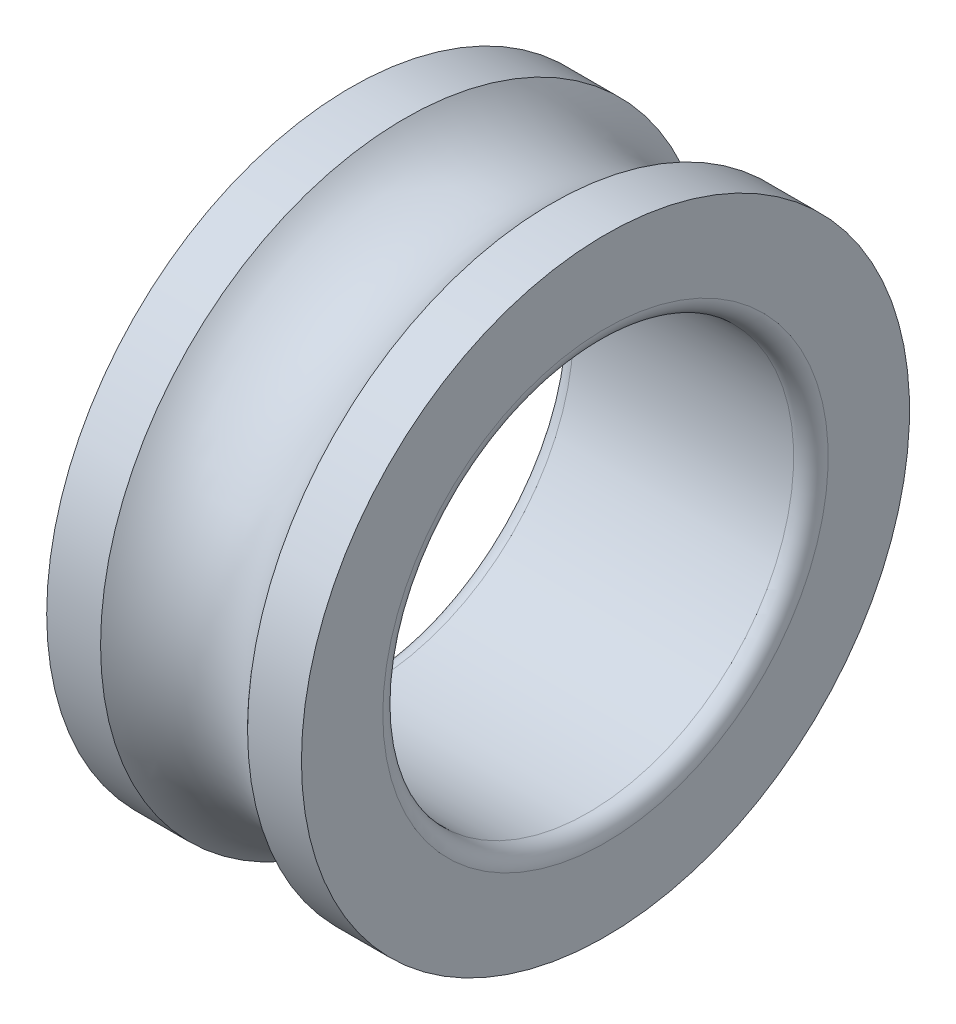
from build123d import *


with BuildPart() as part:
    # Sketch1 → Revolve1 (revolve)
    with BuildSketch(Plane.XY, mode=Mode.PRIVATE) as revolve1_sk:
        with BuildLine():
            Line((-0.55, 25), (-27.35, 25))
            ThreePointArc((-27.35, 25), (-28.83492424, 25.61507576), (-29.45, 27.1))
            Line((-29.45, 27.1), (-29.45, 37))
            Line((-29.45, 37), (-22.89427191, 37))
            ThreePointArc((-22.89427191, 37), (-13.95, 33), (-5.00572809, 37))
            Line((-5.00572809, 37), (1.55, 37))
            Line((1.55, 37), (1.55, 27.1))
            ThreePointArc((1.55, 27.1), (0.93492424, 25.61507576), (-0.55, 25))
        make_face()
    revolve(revolve1_sk.sketch.rotate(Axis((-1.750588235, 0, 0), (1, 0, 0)), 90), axis=Axis((-1.750588235, 0, 0), (1, 0, 0)))


solid = part.part
